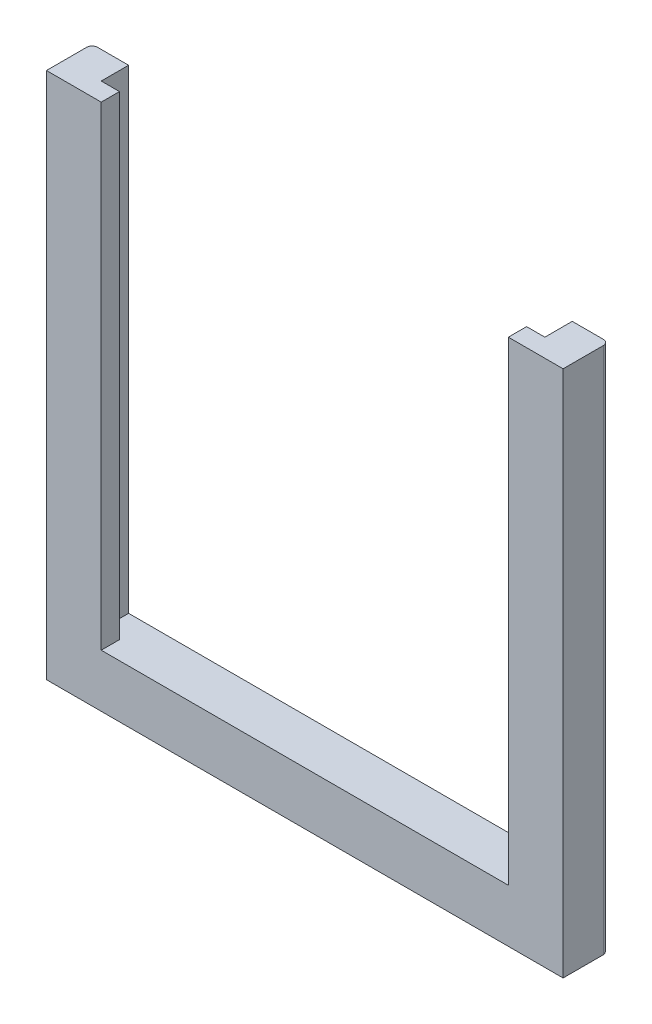
from build123d import *

# Parameters (mm, degrees)
ESBO_O1_W                = 28.3
ESBO_O1_H                = 28.9
RESSALTO_EXTRUS_O1_DEPTH = 2.5
FILETE1_R                = 0.3
CORTE_EXTRUS_O1_DEPTH    = 26


with BuildPart() as part:
    # Esboço1 → Ressalto-extrusão1 (new body)
    with BuildSketch(Plane.XY):
        with Locations((14.15, 14.45)):
            Rectangle(ESBO_O1_W, ESBO_O1_H)
    extrude(amount=RESSALTO_EXTRUS_O1_DEPTH)

    # Filete1
    filete1_edges = [part.edges().sort_by_distance(p)[0] for p in [
        (28.3, 14.45, 0),
        (14.15, 0, 0),
        (0, 14.45, 0),
    ]]
    fillet(filete1_edges, radius=FILETE1_R)

    # Esboço2 → Corte-extrusão1 (cut)
    with BuildSketch(Plane(origin=(0, 28.9, 0), x_dir=(1, 0, 0), z_dir=(0, 1, 0))):
        Polygon((26.3, 0), (2, 0), (2, -1.5), (3, -1.5), (3, -2.5), (25.3, -2.5), (25.3, -1.5), (26.3, -1.5), align=None)
    extrude(amount=-CORTE_EXTRUS_O1_DEPTH, mode=Mode.SUBTRACT)


solid = part.part
